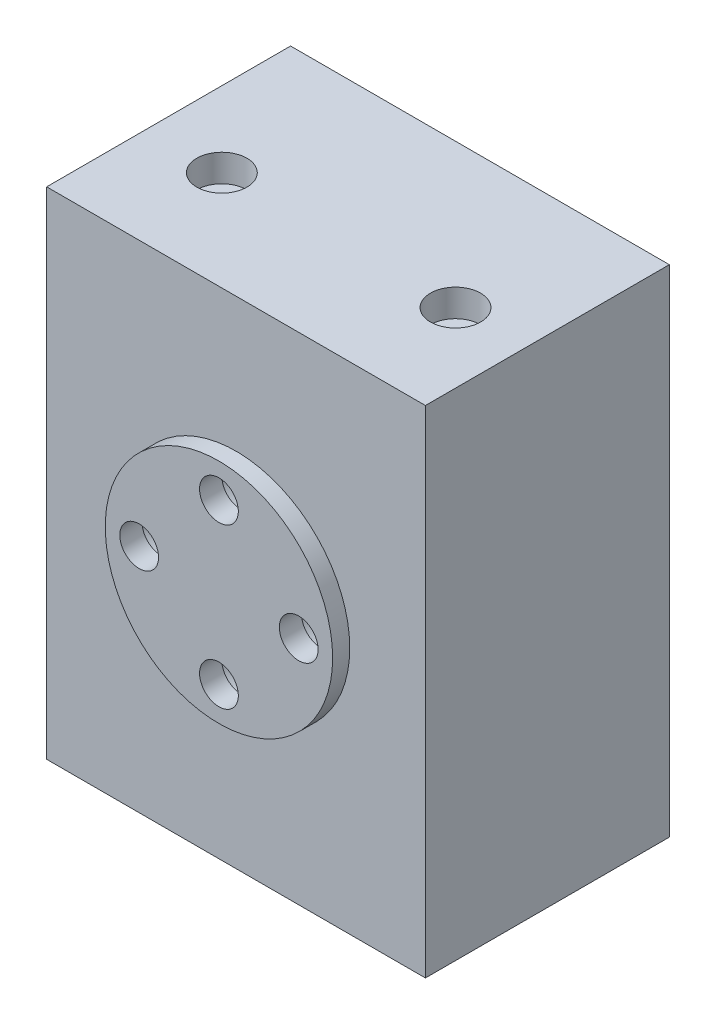
from build123d import *

# Parameters (mm, degrees)
SKETCH1_R                                           = 9.975
BOSS_EXTRUDE1_DEPTH                                 = 1.5
SKETCH3_W                                           = 25.23
SKETCH3_H                                           = 35.5
BOSS_EXTRUDE4_DEPTH                                 = 2.65
SKETCH3_5_W                                         = 33.23
SKETCH3_5_H                                         = 43.5
SKETCH3_5_W_2                                       = 25.23
SKETCH3_5_H_2                                       = 35.5
BOSS_EXTRUDE5_DEPTH                                 = 21.4
SKETCH4_W                                           = 5.2
SKETCH4_H                                           = 1.1
SKETCH4_W_2                                         = 3.2
SKETCH4_H_2                                         = 1.5
SKETCH4_H_3                                         = 1.75
BOSS_EXTRUDE6_DEPTH                                 = 18.9
SKETCH6_W                                           = 18.83
SKETCH6_H                                           = 1.75
BOSS_EXTRUDE7_DEPTH                                 = 5.3
SKETCH2_R                                           = 1.6
CUT_EXTRUDE1_DEPTH                                  = 37
CBORE_FOR_M3_HEX_SOCKET_HEAD_CAP_SCREW1_D           = 3.4
CBORE_FOR_M3_HEX_SOCKET_HEAD_CAP_SCREW1_DEPTH       = 4.15
CBORE_FOR_M3_HEX_SOCKET_HEAD_CAP_SCREW1_CBORE_D     = 5.8
CBORE_FOR_M3_HEX_SOCKET_HEAD_CAP_SCREW1_CBORE_DEPTH = 2.2
CBORE_FOR_M2_HEX_SOCKET_HEAD_CAP_SCREW1_D           = 2.4
CBORE_FOR_M2_HEX_SOCKET_HEAD_CAP_SCREW1_DEPTH       = 6.5
CBORE_FOR_M2_HEX_SOCKET_HEAD_CAP_SCREW1_CBORE_D     = 4.4
CBORE_FOR_M2_HEX_SOCKET_HEAD_CAP_SCREW1_CBORE_DEPTH = 2.4
CBORE_FOR_M2_HEX_SOCKET_HEAD_CAP_SCREW1_TIP         = 0.721032743
CBORE_FOR_M2_HEX_SOCKET_HEAD_CAP_SCREW2_D           = 2.4
CBORE_FOR_M2_HEX_SOCKET_HEAD_CAP_SCREW2_DEPTH       = 6.5
CBORE_FOR_M2_HEX_SOCKET_HEAD_CAP_SCREW2_CBORE_D     = 4.4
CBORE_FOR_M2_HEX_SOCKET_HEAD_CAP_SCREW2_CBORE_DEPTH = 2.4
CBORE_FOR_M2_HEX_SOCKET_HEAD_CAP_SCREW2_TIP         = 0.721032743


with BuildPart() as part:
    # Sketch1 → Boss-Extrude1 (new body)
    with BuildSketch(Plane.XY):
        Circle(SKETCH1_R)
    extrude(amount=BOSS_EXTRUDE1_DEPTH)

    # Sketch3 → Boss-Extrude4 (add)
    with BuildSketch(Plane(origin=(0, 0, 0), x_dir=(-1, 0, 0), z_dir=(0, 0, -1))):
        Rectangle(SKETCH3_W, SKETCH3_H)
    extrude(amount=BOSS_EXTRUDE4_DEPTH)

    # Sketch3<5> → Boss-Extrude5 (add)
    with BuildSketch(Plane(origin=(0, 0, 0), x_dir=(-1, 0, 0), z_dir=(0, 0, -1))):
        Rectangle(SKETCH3_5_W, SKETCH3_5_H)
        Rectangle(SKETCH3_5_W_2, SKETCH3_5_H_2, mode=Mode.SUBTRACT)
    extrude(amount=BOSS_EXTRUDE5_DEPTH)

    # Sketch4 → Boss-Extrude6 (add)
    with BuildSketch(Plane(origin=(0, 0, -2.65), x_dir=(-1, 0, 0), z_dir=(0, 0, -1))):
        with Locations((10.015, 17.2)):
            Rectangle(SKETCH4_W, SKETCH4_H)
        with Locations((-10.015, 17.2)):
            Rectangle(SKETCH4_W, SKETCH4_H)
        with Locations((11.015, -17)):
            Rectangle(SKETCH4_W_2, SKETCH4_H_2)
        with Locations((-11.015, -16.875)):
            Rectangle(SKETCH4_W_2, SKETCH4_H_3)
    extrude(amount=BOSS_EXTRUDE6_DEPTH)

    # Sketch6 → Boss-Extrude7 (add)
    with BuildSketch(Plane(origin=(0, 0, -2.65), x_dir=(-1, 0, 0), z_dir=(0, 0, -1))):
        with Locations((0, -16.875)):
            Rectangle(SKETCH6_W, SKETCH6_H)
    extrude(amount=BOSS_EXTRUDE7_DEPTH)

    # Sketch2 → Cut-Extrude1 (cut)
    with BuildSketch(Plane.XY.offset(1.5)):
        with Locations((7, 0)):
            Circle(SKETCH2_R)
        with Locations((0, -7)):
            Circle(SKETCH2_R)
        with Locations((-7, 0)):
            Circle(SKETCH2_R)
        with Locations((0, 7)):
            Circle(SKETCH2_R)
    extrude(amount=-CUT_EXTRUDE1_DEPTH, mode=Mode.SUBTRACT)

    # CBORE for M3 Hex Socket Head Cap Screw1
    with Locations(Plane(origin=(0, 0, -2.65), x_dir=(-1, 0, 0), z_dir=(0, 0, -1))):
        with Locations((0, 7.000001873), (-7.000001873, 0), (0, -7), (7, 0)):
            CounterBoreHole(CBORE_FOR_M3_HEX_SOCKET_HEAD_CAP_SCREW1_D / 2, CBORE_FOR_M3_HEX_SOCKET_HEAD_CAP_SCREW1_CBORE_D / 2, CBORE_FOR_M3_HEX_SOCKET_HEAD_CAP_SCREW1_CBORE_DEPTH, depth=CBORE_FOR_M3_HEX_SOCKET_HEAD_CAP_SCREW1_DEPTH)

    # CBORE for M2 Hex Socket Head Cap Screw1
    with Locations(Plane.XZ.offset(21.75)):
        with Locations((-10.005, -5.01), (10.495, -5.01)):
            CounterBoreHole(CBORE_FOR_M2_HEX_SOCKET_HEAD_CAP_SCREW1_D / 2, CBORE_FOR_M2_HEX_SOCKET_HEAD_CAP_SCREW1_CBORE_D / 2, CBORE_FOR_M2_HEX_SOCKET_HEAD_CAP_SCREW1_CBORE_DEPTH, depth=CBORE_FOR_M2_HEX_SOCKET_HEAD_CAP_SCREW1_DEPTH)
            with Locations((0, 0, -(CBORE_FOR_M2_HEX_SOCKET_HEAD_CAP_SCREW1_DEPTH + CBORE_FOR_M2_HEX_SOCKET_HEAD_CAP_SCREW1_TIP / 2))):  # 118° drill point
                Cone(0, CBORE_FOR_M2_HEX_SOCKET_HEAD_CAP_SCREW1_D / 2, CBORE_FOR_M2_HEX_SOCKET_HEAD_CAP_SCREW1_TIP, mode=Mode.SUBTRACT)

    # CBORE for M2 Hex Socket Head Cap Screw2
    with Locations(Plane(origin=(0, 21.75, 0), x_dir=(1, 0, 0), z_dir=(0, 1, 0))):
        with Locations((-10.005, 8.76), (10.495, 8.76)):
            CounterBoreHole(CBORE_FOR_M2_HEX_SOCKET_HEAD_CAP_SCREW2_D / 2, CBORE_FOR_M2_HEX_SOCKET_HEAD_CAP_SCREW2_CBORE_D / 2, CBORE_FOR_M2_HEX_SOCKET_HEAD_CAP_SCREW2_CBORE_DEPTH, depth=CBORE_FOR_M2_HEX_SOCKET_HEAD_CAP_SCREW2_DEPTH)
            with Locations((0, 0, -(CBORE_FOR_M2_HEX_SOCKET_HEAD_CAP_SCREW2_DEPTH + CBORE_FOR_M2_HEX_SOCKET_HEAD_CAP_SCREW2_TIP / 2))):  # 118° drill point
                Cone(0, CBORE_FOR_M2_HEX_SOCKET_HEAD_CAP_SCREW2_D / 2, CBORE_FOR_M2_HEX_SOCKET_HEAD_CAP_SCREW2_TIP, mode=Mode.SUBTRACT)


solid = part.part
